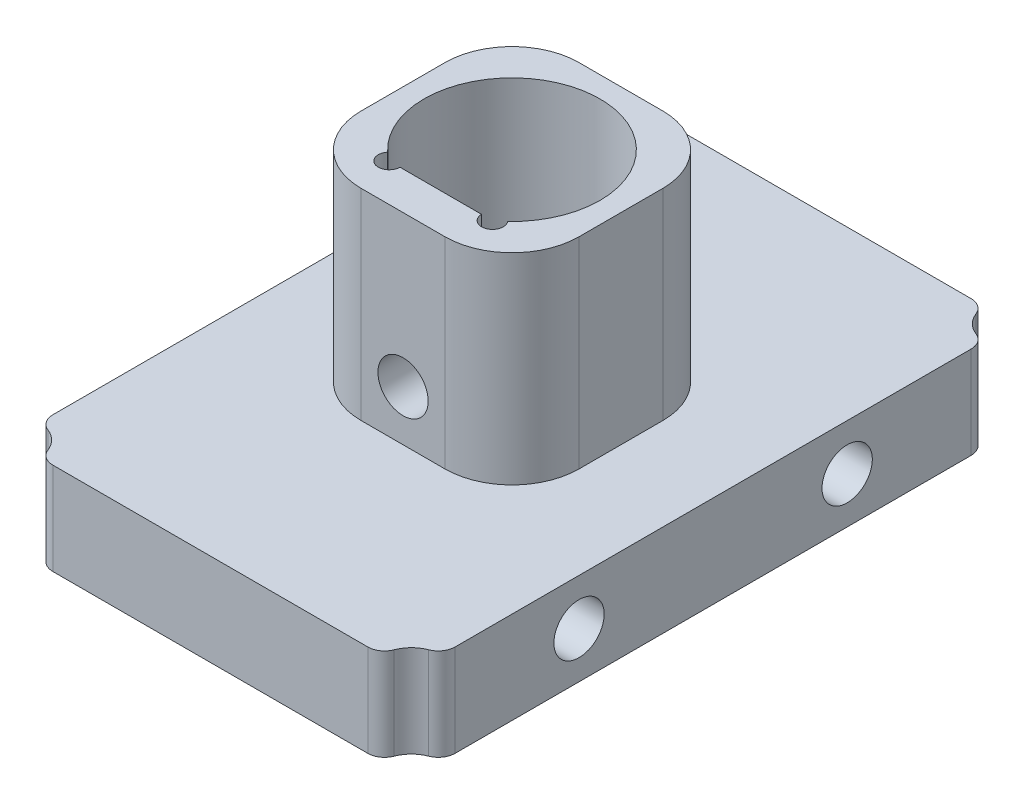
from build123d import *

# Parameters (mm, degrees)
EXTRUDE_1_DEPTH     = 12
EXTRUDE_3_DEPTH     = 5.5
SKETCH_6_R          = 1.5
CUT_EXTRUDE_2_DEPTH = 31
SKETCH_7_R          = 1.5
CUT_EXTRUDE_3_DEPTH = 31
SKETCH_8_R          = 2.5
CUT_EXTRUDE_5_DEPTH = 31
EXTRUDE_START       = -24
SKETCH_9_R          = 1.5
EXTRUDE_4_DEPTH     = 24
SKETCH_10_R         = 2.5
CUT_EXTRUDE_6_DEPTH = 24


with BuildPart() as part:
    # 草图1 → 凸台-拉伸1 (new body)
    with BuildSketch(Plane(origin=(0, 0, 0), x_dir=(1, 0, 0), z_dir=(0, 1, 0))):
        with BuildLine():
            ThreePointArc((6.5, -2.5), (5.328427125, -5.328427125), (2.5, -6.5))
            Line((2.5, -6.5), (-2.5, -6.5))
            ThreePointArc((-2.5, -6.5), (-5.328427125, -5.328427125), (-6.5, -2.5))
            Line((-6.5, -2.5), (-6.5, 2.5))
            ThreePointArc((-6.5, 2.5), (-5.328427125, 5.328427125), (-2.5, 6.5))
            Line((-2.5, 6.5), (2.5, 6.5))
            ThreePointArc((2.5, 6.5), (5.328427125, 5.328427125), (6.5, 2.5))
            Line((6.5, 2.5), (6.5, -2.5))
        make_face()
        with BuildLine():
            ThreePointArc((3.581278005, -3.838873253), (0, 5.25), (-3.581278005, -3.838873253))
            ThreePointArc((-3.581278005, -3.838873253), (-3.300605298, -4.858604348), (-2.435602742, -4.25))
            Line((-2.435602742, -4.25), (2.435602742, -4.25))
            ThreePointArc((2.435602742, -4.25), (3.300605298, -4.858604348), (3.581278005, -3.838873253))
        make_face(mode=Mode.SUBTRACT)
    extrude(amount=EXTRUDE_1_DEPTH)

    # 草图3 → 凸台-拉伸3 (add)
    with BuildSketch(Plane.XZ):
        with BuildLine():
            Line((12, 15.394651328), (12, -15.394651328))
            ThreePointArc((12, -15.394651328), (11.824116747, -15.961071302), (11.358336826, -16.328243701))
            ThreePointArc((11.358336826, -16.328243701), (10.733804764, -16.733804764), (10.328243701, -17.358336826))
            ThreePointArc((10.328243701, -17.358336826), (9.961071302, -17.824116747), (9.394651328, -18))
            Line((9.394651328, -18), (-9.394651328, -18))
            ThreePointArc((-9.394651328, -18), (-9.961071302, -17.824116747), (-10.328243701, -17.358336826))
            ThreePointArc((-10.328243701, -17.358336826), (-10.733804764, -16.733804764), (-11.358336826, -16.328243701))
            ThreePointArc((-11.358336826, -16.328243701), (-11.824116747, -15.961071302), (-12, -15.394651328))
            Line((-12, -15.394651328), (-12, 15.394651328))
            ThreePointArc((-12, 15.394651328), (-11.824116747, 15.961071302), (-11.358336826, 16.328243701))
            ThreePointArc((-11.358336826, 16.328243701), (-10.733804764, 16.733804764), (-10.328243701, 17.358336826))
            ThreePointArc((-10.328243701, 17.358336826), (-9.961071302, 17.824116747), (-9.394651328, 18))
            Line((-9.394651328, 18), (9.394651328, 18))
            ThreePointArc((9.394651328, 18), (9.961071302, 17.824116747), (10.328243701, 17.358336826))
            ThreePointArc((10.328243701, 17.358336826), (10.733804764, 16.733804764), (11.358336826, 16.328243701))
            ThreePointArc((11.358336826, 16.328243701), (11.824116747, 15.961071302), (12, 15.394651328))
        make_face()
    extrude(amount=EXTRUDE_3_DEPTH)

    # 草图6 → 切除-拉伸2 (cut)
    with BuildSketch(Plane.ZY.offset(12)):
        with Locations((0, -2.75)):
            Circle(SKETCH_6_R)
        with Locations((8, -2.75)):
            Circle(SKETCH_6_R)
        with Locations((-8, -2.75)):
            Circle(SKETCH_6_R)
    extrude(amount=-CUT_EXTRUDE_2_DEPTH, mode=Mode.SUBTRACT)

    # 草图7 → 切除-拉伸3 (cut)
    with BuildSketch(Plane.XY.offset(6.5)):
        with Locations((0, 3)):
            Circle(SKETCH_7_R)
    extrude(amount=-CUT_EXTRUDE_3_DEPTH, mode=Mode.SUBTRACT)

    # 草图8 → 切除-拉伸5 (cut)
    with BuildSketch(Plane.XZ.offset(5.5)):
        with Locations(Location((0, 0, 0), (0, 0, 270))):
            Circle(SKETCH_8_R)
    extrude(amount=-CUT_EXTRUDE_5_DEPTH, mode=Mode.SUBTRACT)

    # 草图9 → 凸台-拉伸4 (add)
    with BuildSketch(Plane(origin=(12, 0, 0), x_dir=(0, 0, -1), z_dir=(1, 0, 0)).offset(EXTRUDE_START)):
        with Locations(Location((0, -2.75, 0), (0, 0, 180))):
            Circle(SKETCH_9_R)
    extrude(amount=EXTRUDE_4_DEPTH)

    # 草图10 → 切除-拉伸6 (cut)
    with BuildSketch(Plane.XZ.offset(5.5)):
        with Locations(Location((0, 0, 0), (0, 0, 270))):
            Circle(SKETCH_10_R)
    extrude(amount=-CUT_EXTRUDE_6_DEPTH, mode=Mode.SUBTRACT)


solid = part.part
